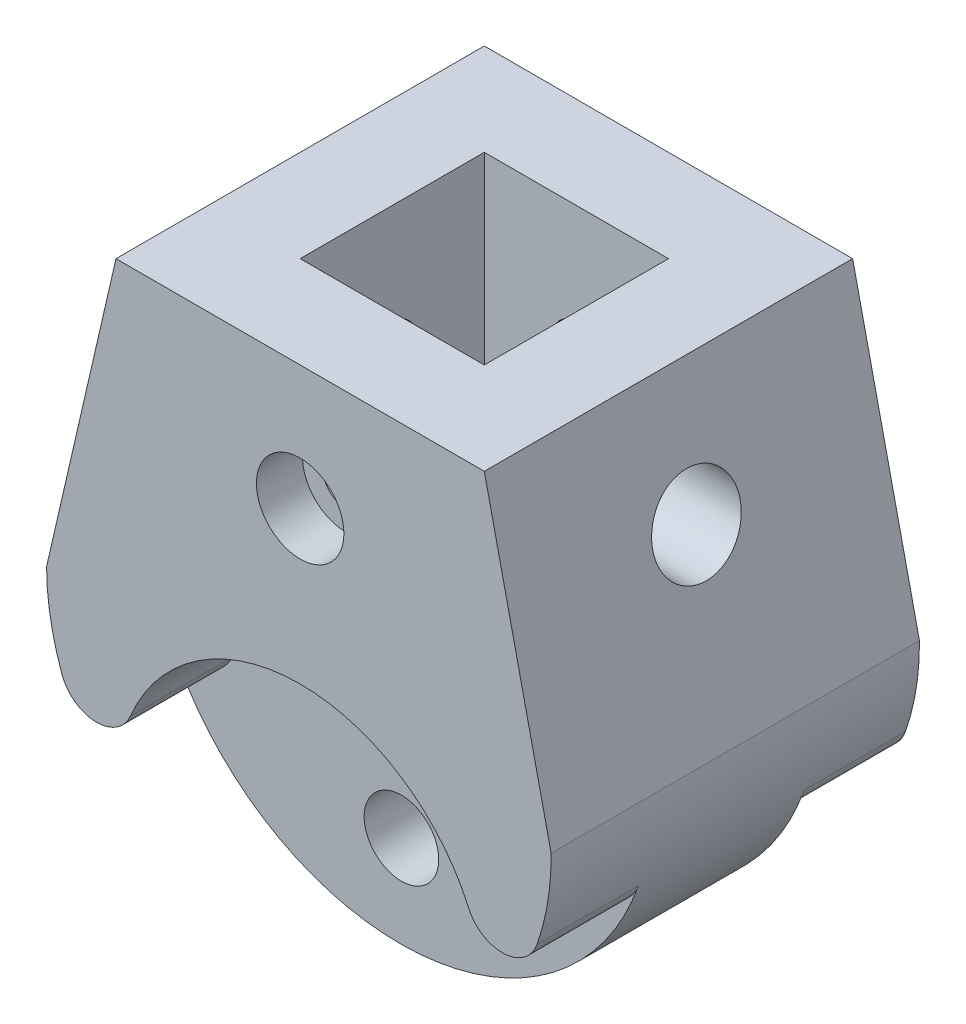
from build123d import *

# Parameters (mm, degrees)
SALIENTE_EXTRUIR1_DEPTH = 40
CROQUIS2_R              = 4.05
CORTAR_EXTRUIR1_DEPTH   = 40
CROQUIS3_R              = 20
CORTAR_EXTRUIR10_DEPTH  = 11
CORTAR_EXTRUIR11_START  = -11
CROQUIS4_R              = 20
CORTAR_EXTRUIR11_DEPTH  = 11
CROQUIS5_W              = 20
CROQUIS5_H              = 20
CORTAR_EXTRUIR12_DEPTH  = 27
CROQUIS6_R              = 2.55
CORTAR_EXTRUIR13_DEPTH  = 47
CROQUIS7_R              = 4.75
CORTAR_EXTRUIR14_DEPTH  = 5
CORTAR_EXTRUIR15_START  = -5
CROQUIS8_R              = 4.75
CORTAR_EXTRUIR15_DEPTH  = 5
CROQUIS10_R             = 2.55
CORTAR_EXTRUIR16_DEPTH  = 61
CROQUIS11_R             = 4.75
CORTAR_EXTRUIR17_DEPTH  = 12
CORTAR_EXTRUIR18_START  = -12
CROQUIS12_R             = 4.75
CORTAR_EXTRUIR18_DEPTH  = 12
REDONDEO2_R             = 4


with BuildPart() as part:
    # Croquis1 → Saliente-Extruir1 (new body)
    with BuildSketch(Plane.XY):
        with BuildLine():
            Line((-20, 50), (20, 50))
            Line((20, 50), (27.254710371, 17.703975897))
            ThreePointArc((27.254710371, 17.703975897), (19.389172744, -1.816392263), (0, -10))
            ThreePointArc((0, -10), (-19.415198008, -2.076028365), (-27.5407221, 17.255683881))
            Line((-27.5407221, 17.255683881), (-20, 50))
        make_face()
    extrude(amount=SALIENTE_EXTRUIR1_DEPTH)

    # Croquis2 → Cortar-Extruir1 (cut)
    with BuildSketch(Plane.XY.offset(40)):
        Circle(CROQUIS2_R)
    extrude(amount=-CORTAR_EXTRUIR1_DEPTH, mode=Mode.SUBTRACT)

    # Croquis3 → Cortar-Extruir10 (cut)
    with BuildSketch(Plane.XY.offset(40)):
        Circle(CROQUIS3_R)
    extrude(amount=-CORTAR_EXTRUIR10_DEPTH, mode=Mode.SUBTRACT)

    # Croquis4 → Cortar-Extruir11 (cut)
    with BuildSketch(Plane(origin=(0, 0, 0), x_dir=(-1, 0, 0), z_dir=(0, 0, -1)).offset(CORTAR_EXTRUIR11_START)):
        Circle(CROQUIS4_R)
    extrude(amount=CORTAR_EXTRUIR11_DEPTH, mode=Mode.SUBTRACT)

    # Croquis5 → Cortar-Extruir12 (cut)
    with BuildSketch(Plane(origin=(0, 50, 0), x_dir=(1, 0, 0), z_dir=(0, 1, 0))):
        with Locations((0, -20)):
            Rectangle(CROQUIS5_W, CROQUIS5_H)
    extrude(amount=-CORTAR_EXTRUIR12_DEPTH, mode=Mode.SUBTRACT)

    # Croquis6 → Cortar-Extruir13 (cut)
    with BuildSketch(Plane.XY.offset(40)):
        with Locations((0, 36.5)):
            Circle(CROQUIS6_R)
    extrude(amount=-CORTAR_EXTRUIR13_DEPTH, mode=Mode.SUBTRACT)

    # Croquis7 → Cortar-Extruir14 (cut)
    with BuildSketch(Plane.XY.offset(40)):
        with Locations((0, 36.5)):
            Circle(CROQUIS7_R)
    extrude(amount=-CORTAR_EXTRUIR14_DEPTH, mode=Mode.SUBTRACT)

    # Croquis8 → Cortar-Extruir15 (cut)
    with BuildSketch(Plane(origin=(0, 0, 0), x_dir=(-1, 0, 0), z_dir=(0, 0, -1)).offset(CORTAR_EXTRUIR15_START)):
        with Locations(Location((0, 36.5, 0), (0, 0, 180))):
            Circle(CROQUIS8_R)
    extrude(amount=CORTAR_EXTRUIR15_DEPTH, mode=Mode.SUBTRACT)

    # Croquis10 → Cortar-Extruir16 (cut)
    with BuildSketch(Plane(origin=(27.254710371, 0, 0), x_dir=(0, 0, -1), z_dir=(1, 0, 0))):
        with Locations(Location((-20, 36.5, 0), (0, 0, 90))):
            Circle(CROQUIS10_R)
    extrude(amount=-CORTAR_EXTRUIR16_DEPTH, mode=Mode.SUBTRACT)

    # Croquis11 → Cortar-Extruir17 (cut)
    with BuildSketch(Plane(origin=(27.254710371, 0, 0), x_dir=(0, 0, -1), z_dir=(1, 0, 0))):
        with Locations((-20, 36.5)):
            Circle(CROQUIS11_R)
    extrude(amount=-CORTAR_EXTRUIR17_DEPTH, mode=Mode.SUBTRACT)

    # Croquis12 → Cortar-Extruir18 (cut)
    with BuildSketch(Plane.ZY.offset(27.5407221).offset(CORTAR_EXTRUIR18_START)):
        with Locations(Location((20, 36.5, 0), (0, 0, 180))):
            Circle(CROQUIS12_R)
    extrude(amount=CORTAR_EXTRUIR18_DEPTH, mode=Mode.SUBTRACT)

    # Redondeo2
    redondeo2_edges = [part.edges().sort_by_distance(p)[0] for p in [
        (19.96305599, -1.215070179, 34.5),
        (-19.940485513, -1.541764408, 34.5),
        (-19.940485513, -1.541764408, 5.5),
        (19.96305599, -1.215070179, 5.5),
    ]]
    fillet(redondeo2_edges, radius=REDONDEO2_R)


solid = part.part
